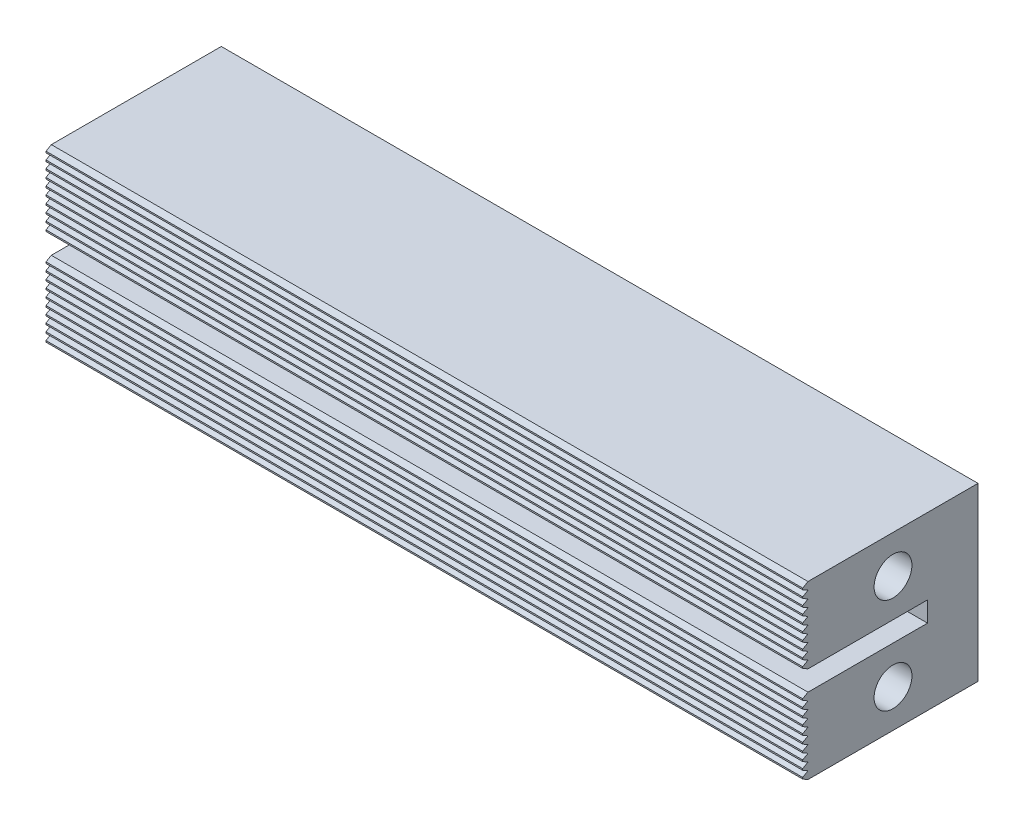
from build123d import *

# Parameters (mm, degrees)
SKETCH1_W           = 150
SKETCH1_H           = 34
BOSS_EXTRUDE1_DEPTH = 35
CUT_EXTRUDE1_DEPTH  = 160
CUT_EXTRUDE7_DEPTH  = 160
SKETCH6_W           = 0.25
SKETCH6_H           = 34
CUT_EXTRUDE8_DEPTH  = 160
SKETCH7_R           = 3.75
CUT_EXTRUDE9_DEPTH  = 160
CUT_EXTRUDE10_START = -5
SKETCH8_R           = 3.5
CUT_EXTRUDE10_DEPTH = 5


with BuildPart() as part:
    # Sketch1 → Boss-Extrude1 (new body)
    with BuildSketch(Plane.XY):
        with Locations((75, 17)):
            Rectangle(SKETCH1_W, SKETCH1_H)
    extrude(amount=BOSS_EXTRUDE1_DEPTH)

    # Sketch2 → Cut-Extrude1 (cut)
    with BuildSketch(Plane(origin=(150, 0, 0), x_dir=(0, 0, -1), z_dir=(1, 0, 0))):
        Polygon((-35, 17), (-35, 19), (-10, 19), (-10, 15), (-35, 15), align=None)
    extrude(amount=-CUT_EXTRUDE1_DEPTH, mode=Mode.SUBTRACT)

    # Sketch3 → Cut-Extrude7 (cut)
    with BuildSketch(Plane(origin=(150, 0, 0), x_dir=(0, 0, -1), z_dir=(1, 0, 0))):
        Polygon((-33.7, 19), (-35, 19.75), (-35, 18.25), align=None)
        Polygon((-33.7, 20.5), (-35, 21.25), (-35, 19.75), align=None)
        Polygon((-33.7, 22), (-35, 22.75), (-35, 21.25), align=None)
        Polygon((-33.7, 23.5), (-35, 24.25), (-35, 22.75), align=None)
        Polygon((-33.7, 25), (-35, 25.75), (-35, 24.25), align=None)
        Polygon((-33.7, 26.5), (-35, 27.25), (-35, 25.75), align=None)
        Polygon((-33.7, 28), (-35, 28.75), (-35, 27.25), align=None)
        Polygon((-33.7, 29.5), (-35, 30.25), (-35, 28.75), align=None)
        Polygon((-35, 34), (-35, 33.25), (-33.7, 34), align=None)
        Polygon((-35, 33.25), (-35, 31.75), (-33.7, 32.5), align=None)
        Polygon((-33.7, 31), (-35, 31.75), (-35, 30.25), align=None)
    cut_extrude7 = extrude(amount=-CUT_EXTRUDE7_DEPTH, mode=Mode.SUBTRACT)

    # Mirror1: Cut-Extrude7 across plane
    add(cut_extrude7.mirror(Plane.ZX.offset(17)), mode=Mode.SUBTRACT)

    # Sketch6 → Cut-Extrude8 (cut)
    with BuildSketch(Plane(origin=(150, 0, 0), x_dir=(0, 0, -1), z_dir=(1, 0, 0))):
        with Locations((-34.875, 17)):
            Rectangle(SKETCH6_W, SKETCH6_H)
    extrude(amount=-CUT_EXTRUDE8_DEPTH, mode=Mode.SUBTRACT)

    # Sketch7 → Cut-Extrude9 (cut)
    with BuildSketch(Plane(origin=(150, 0, 0), x_dir=(0, 0, -1), z_dir=(1, 0, 0))):
        with Locations((-16.85, 26.5)):
            Circle(SKETCH7_R)
        with Locations((-16.85, 7.5)):
            Circle(SKETCH7_R)
    extrude(amount=-CUT_EXTRUDE9_DEPTH, mode=Mode.SUBTRACT)

    # Sketch8 → Cut-Extrude10 (cut)
    with BuildSketch(Plane.XY.offset(10).offset(CUT_EXTRUDE10_START)):
        with Locations((100, 17)):
            Circle(SKETCH8_R)
        with Locations((50, 17)):
            Circle(SKETCH8_R)
    extrude(amount=-CUT_EXTRUDE10_DEPTH, mode=Mode.SUBTRACT)


solid = part.part
